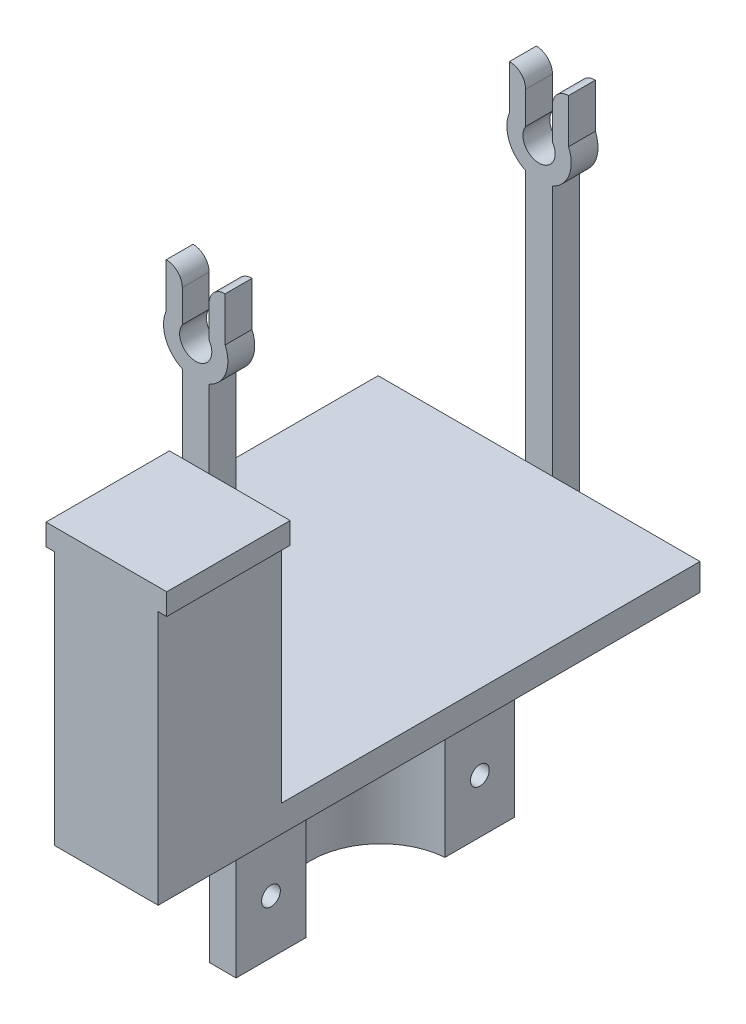
from build123d import *

# Parameters (mm, degrees)
BOSS_EXTRUDE1_DEPTH = 5
SKETCH2_W           = 32.5
SKETCH2_H           = 5
BOSS_EXTRUDE2_DEPTH = 14
BOSS_EXTRUDE3_DEPTH = 23
SKETCH4_W           = 60
SKETCH4_H           = 5
BOSS_EXTRUDE4_DEPTH = 59
BOSS_EXTRUDE5_START = 5
BOSS_EXTRUDE5_DEPTH = 5
BOSS_EXTRUDE6_DEPTH = 50
SKETCH7_R           = 1.75
CUT_EXTRUDE1_DEPTH  = 130.133002576


with BuildPart() as part:
    # Sketch1 → Boss-Extrude1 (new body)
    with BuildSketch(Plane.XY):
        with BuildLine():
            Line((-2.5, -5.454356057), (-2.5, -57.315294131))
            Line((-2.5, -57.315294131), (30, -57.315294131))
            Line((30, -57.315294131), (30, -52.315294131))
            Line((30, -52.315294131), (2.5, -52.315294131))
            Line((2.5, -52.315294131), (2.5, -5.454356057))
            ThreePointArc((2.5, -5.454356057), (5.604867811, -2.141367979), (5.5, 2.397915762))
            Line((5.5, 2.397915762), (5.5, 10.658312395))
            ThreePointArc((5.5, 10.658312395), (3.378679656, 9.779632739), (2.5, 7.658312395))
            Line((2.5, 7.658312395), (2.5, 1.658312395))
            ThreePointArc((2.5, 1.658312395), (0, -3), (-2.5, 1.658312395))
            Line((-2.5, 1.658312395), (-2.5, 7.658312395))
            ThreePointArc((-2.5, 7.658312395), (-3.378679656, 9.779632739), (-5.5, 10.658312395))
            Line((-5.5, 10.658312395), (-5.5, 2.397915762))
            ThreePointArc((-5.5, 2.397915762), (-5.604867811, -2.141367979), (-2.5, -5.454356057))
        make_face()
    extrude(amount=BOSS_EXTRUDE1_DEPTH)

    # Sketch2 → Boss-Extrude2 (add)
    with BuildSketch(Plane.XY.offset(5)):
        with Locations((13.75, -54.815294131)):
            Rectangle(SKETCH2_W, SKETCH2_H)
    extrude(amount=BOSS_EXTRUDE2_DEPTH)

    # Sketch3 → Boss-Extrude3 (add)
    with BuildSketch(Plane.XY.offset(19)):
        Polygon((10.7, -57.315294131), (10.7, -9.9), (9.1, -9.9), (9.1, -5.9), (31.6, -5.9), (31.6, -9.9), (30, -9.9), (30, -57.315294131), align=None)
    extrude(amount=BOSS_EXTRUDE3_DEPTH)

    # Sketch4 → Boss-Extrude4 (add)
    with BuildSketch(Plane(origin=(0, 0, 0), x_dir=(-1, 0, 0), z_dir=(0, 0, -1))):
        with Locations((0, -54.815294131)):
            Rectangle(SKETCH4_W, SKETCH4_H)
    extrude(amount=BOSS_EXTRUDE4_DEPTH)

    # Sketch5 → Boss-Extrude5 (add)
    with BuildSketch(Plane(origin=(0, 0, -59), x_dir=(-1, 0, 0), z_dir=(0, 0, -1)).offset(BOSS_EXTRUDE5_START)):
        with BuildLine():
            Line((-2.5, -57.315294131), (2.5, -57.315294131))
            Line((2.5, -57.315294131), (2.5, -5.454356057))
            ThreePointArc((2.5, -5.454356057), (5.604867811, -2.141367979), (5.5, 2.397915762))
            Line((5.5, 2.397915762), (5.5, 10.658312395))
            ThreePointArc((5.5, 10.658312395), (3.378679656, 9.779632739), (2.5, 7.658312395))
            Line((2.5, 7.658312395), (2.5, 1.658312395))
            ThreePointArc((2.5, 1.658312395), (0, -3), (-2.5, 1.658312395))
            Line((-2.5, 1.658312395), (-2.5, 7.658312395))
            ThreePointArc((-2.5, 7.658312395), (-3.378679656, 9.779632739), (-5.5, 10.658312395))
            Line((-5.5, 10.658312395), (-5.5, 2.397915762))
            ThreePointArc((-5.5, 2.397915762), (-5.604867811, -2.141367979), (-2.5, -5.454356057))
            Line((-2.5, -5.454356057), (-2.5, -57.315294131))
        make_face()
    extrude(amount=-BOSS_EXTRUDE5_DEPTH)

    # Sketch6 → Boss-Extrude6 (add)
    with BuildSketch(Plane.XZ.offset(57.315294131)):
        with BuildLine():
            Line((-1, -3.529437252), (-1, -16.538518603))
            ThreePointArc((-1, -16.538518603), (-13, -29.5), (-1, -42.461481397))
            Line((-1, -42.461481397), (-1, -55.470562748))
            Line((-1, -55.470562748), (-6, -55.470562748))
            Line((-6, -55.470562748), (-6, -46.470562748))
            ThreePointArc((-6, -46.470562748), (-18, -29.5), (-6, -12.529437252))
            Line((-6, -12.529437252), (-6, -3.529437252))
            Line((-6, -3.529437252), (-1, -3.529437252))
        make_face()
    extrude(amount=BOSS_EXTRUDE6_DEPTH)

    # Sketch7 → Cut-Extrude1 (cut, through all)
    with BuildSketch(Plane(origin=(-1, 0, 0), x_dir=(0, 0, -1), z_dir=(1, 0, 0))):
        with Locations((10.033977927, -67.315294131)):
            Circle(SKETCH7_R)
        with Locations((10.033977927, -97.315294131)):
            Circle(SKETCH7_R)
        with Locations((48.966022073, -97.315294131)):
            Circle(SKETCH7_R)
        with Locations((48.966022073, -67.315294131)):
            Circle(SKETCH7_R)
    extrude(amount=-CUT_EXTRUDE1_DEPTH, mode=Mode.SUBTRACT)


solid = part.part
